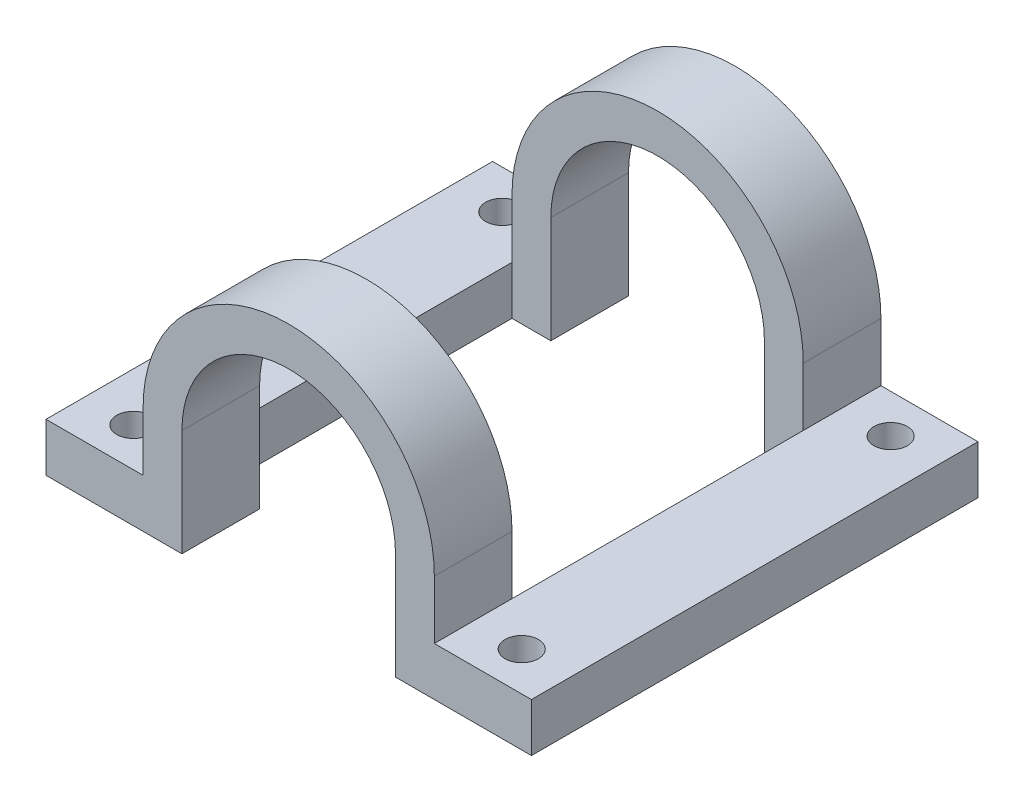
from build123d import *

# Parameters (mm, degrees)
BOSS_EXTRUDE1_DEPTH = 10.16
SKETCH2_R           = 2.1828125
CUT_EXTRUDE1_DEPTH  = 7.62
SKETCH3_W           = 12.7
SKETCH3_H           = 19.05
BOSS_EXTRUDE2_DEPTH = 6.35


with BuildPart() as part:
    # Sketch1 → Boss-Extrude1 (new body)
    with BuildSketch(Plane.XY):
        with BuildLine():
            Line((0, 0), (0, 6.35))
            Line((0, 6.35), (12.7, 6.35))
            Line((12.7, 6.35), (12.7, 13.97))
            ThreePointArc((12.7, 13.97), (31.75, 33.02), (50.8, 13.97))
            Line((50.8, 13.97), (50.8, 6.35))
            Line((50.8, 6.35), (63.5, 6.35))
            Line((63.5, 6.35), (63.5, 0))
            Line((63.5, 0), (45.72, 0))
            Line((45.72, 0), (45.72, 13.97))
            ThreePointArc((45.72, 13.97), (31.75, 27.94), (17.78, 13.97))
            Line((17.78, 13.97), (17.78, 0))
            Line((17.78, 0), (0, 0))
        make_face()
    extrude(amount=BOSS_EXTRUDE1_DEPTH)

    # Sketch2 → Cut-Extrude1 (cut)
    with BuildSketch(Plane(origin=(0, 6.35, 0), x_dir=(1, 0, 0), z_dir=(0, 1, 0))):
        with Locations(Location((6.35, -5.08, 0), (0, 0, 270))):
            Circle(SKETCH2_R)
        with Locations(Location((57.15, -5.08, 0), (0, 0, 270))):
            Circle(SKETCH2_R)
    extrude(amount=-CUT_EXTRUDE1_DEPTH, mode=Mode.SUBTRACT)

    # Sketch3 → Boss-Extrude2 (add)
    with BuildSketch(Plane(origin=(0, 0, 0), x_dir=(1, 0, 0), z_dir=(0, 1, 0))):
        with Locations((6.35, -19.685)):
            Rectangle(SKETCH3_W, SKETCH3_H)
        with Locations((57.15, -19.685)):
            Rectangle(SKETCH3_W, SKETCH3_H)
    extrude(amount=BOSS_EXTRUDE2_DEPTH)

    # Mirror1: part across plane


with BuildPart() as part_1:
    add(part.part)
    add(part.part.mirror(Plane.XY.offset(29.21)))


solid = part_1.part
